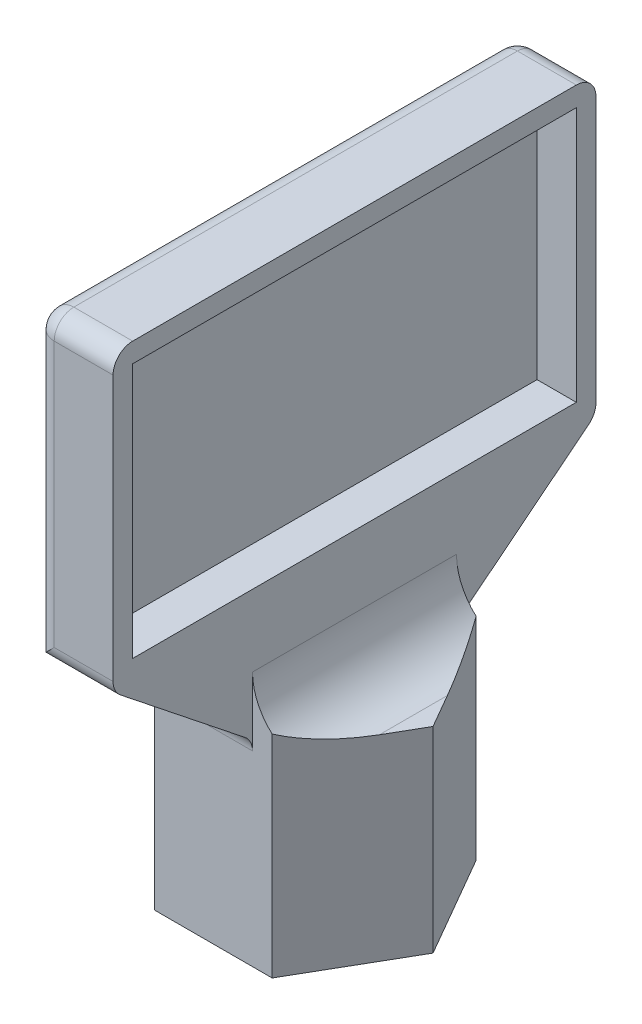
from build123d import *

# Parameters (mm, degrees)
BOSS_EXTRUDE1_DEPTH      = 10
SKETCH2_R                = 3
CUT_EXTRUDE1_DEPTH       = 8
BOSS_EXTRUDE2_DEPTH      = 2
BOSS_EXTRUDE2_DEPTH_BACK = 2
SKETCH4_W                = 22.6
SKETCH4_H                = 13
CUT_EXTRUDE3_DEPTH       = 2
FILLET1_R                = 1
FILLET2_R                = 3


with BuildPart() as part:
    # Sketch1 → Boss-Extrude1 (new body)
    with BuildSketch(Plane(origin=(0, 0, 0), x_dir=(1, 0, 0), z_dir=(0, 1, 0))):
        Polygon((6, 0), (3, 5.196152423), (-3, 5.196152423), (-6, 0), (-3, -5.196152423), (3, -5.196152423), align=None)
    extrude(amount=BOSS_EXTRUDE1_DEPTH)

    # Sketch2 → Cut-Extrude1 (cut)
    with BuildSketch(Plane.XZ):
        Circle(SKETCH2_R)
    extrude(amount=-CUT_EXTRUDE1_DEPTH, mode=Mode.SUBTRACT)

    # Sketch3 → Boss-Extrude2 (add, two sides: drawn at the far end of the back side and taken through both)
    with BuildSketch(Plane(origin=(0, 0, 0), x_dir=(0, 0, -1), z_dir=(1, 0, 0)).offset(-BOSS_EXTRUDE2_DEPTH_BACK)):
        Polygon((5.196152423, 10), (12.3, 15.651732035), (12.3, 30.651732035), (-12.3, 30.651732035), (-12.3, 15.651732035), (-5.196152423, 10), align=None)
    extrude(amount=BOSS_EXTRUDE2_DEPTH + BOSS_EXTRUDE2_DEPTH_BACK)

    # Sketch4 → Cut-Extrude3 (cut)
    with BuildSketch(Plane(origin=(2, 0, 0), x_dir=(0, 0, -1), z_dir=(1, 0, 0))):
        with Locations((0, 23.151732035)):
            Rectangle(SKETCH4_W, SKETCH4_H)
    extrude(amount=-CUT_EXTRUDE3_DEPTH, mode=Mode.SUBTRACT)

    # Fillet1
    fillet1_edges = [part.edges().sort_by_distance(p)[0] for p in [
        (-2, 23.151732035, -12.3),
        (-2, 30.651732035, 0),
        (-2, 23.151732035, 12.3),
        (0, 10, -5.196152423),
        (0, 10, 5.196152423),
        (0, 15.651732035, 12.3),
        (0, 15.651732035, -12.3),
        (0, 30.651732035, -12.3),
        (0, 30.651732035, 12.3),
    ]]
    fillet(fillet1_edges, radius=FILLET1_R)

    # Fillet2
    fillet2_edges = [part.edges().sort_by_distance(p)[0] for p in [
        (-2, 10, 0),
        (2, 10, 0),
    ]]
    fillet(fillet2_edges, radius=FILLET2_R)


solid = part.part
